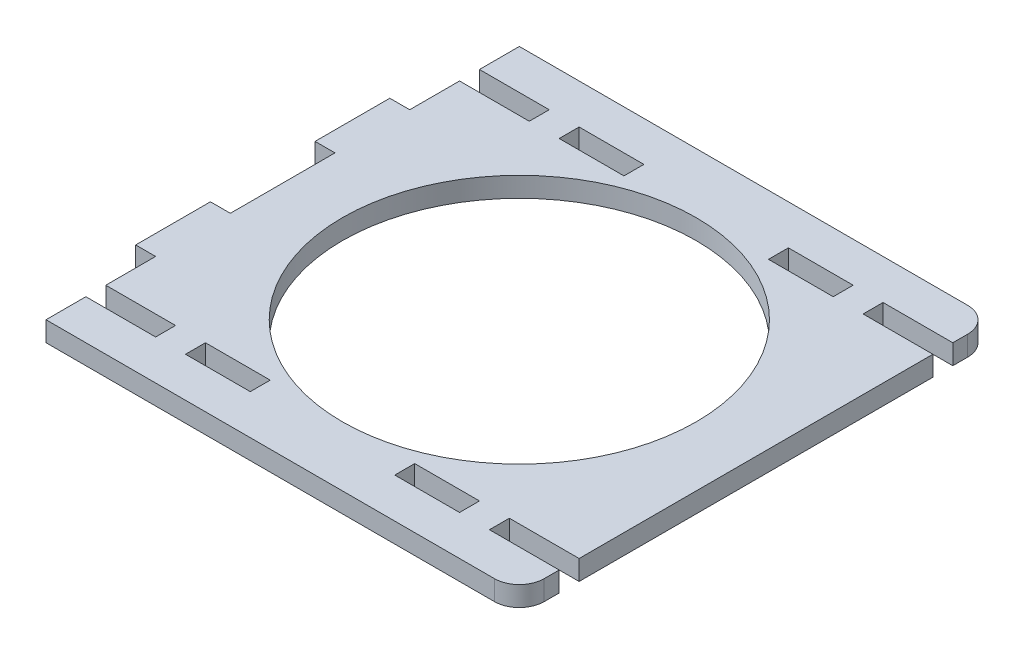
from build123d import *

# Parameters (mm, degrees)
SKETCH1_W           = 95
SKETCH1_H           = 95
SKETCH1_R           = 35.5
BOSS_EXTRUDE1_DEPTH = 2
SKETCH3_W           = 14
SKETCH3_H           = 4
SKETCH3_W_2         = 13
CUT_EXTRUDE5_DEPTH  = 68.294130502
SKETCH4_W           = 15
SKETCH4_H           = 4
BOSS_EXTRUDE2_DEPTH = 4
FILLET1_R           = 5


with BuildPart() as part:
    # Sketch1 → Boss-Extrude1 (new, symmetric)
    with BuildSketch(Plane(origin=(0, 0, 0), x_dir=(1, 0, 0), z_dir=(0, 1, 0))):
        Rectangle(SKETCH1_W, SKETCH1_H)
        Circle(SKETCH1_R, mode=Mode.SUBTRACT)
    extrude(amount=BOSS_EXTRUDE1_DEPTH, both=True)

    # Sketch3 → Cut-Extrude5 (cut, through all)
    with BuildSketch(Plane(origin=(0, 2, 0), x_dir=(1, 0, 0), z_dir=(0, 1, 0))):
        with Locations((-40.5, -37.5)):
            Rectangle(SKETCH3_W, SKETCH3_H)
        with Locations((-40.5, 37.5)):
            Rectangle(SKETCH3_W, SKETCH3_H)
        with Locations((21, 37.5)):
            Rectangle(SKETCH3_W_2, SKETCH3_H)
        with Locations((40.5, -37.5)):
            Rectangle(SKETCH3_W, SKETCH3_H)
        with Locations((40.5, 37.5)):
            Rectangle(SKETCH3_W, SKETCH3_H)
        with Locations((21, -37.5)):
            Rectangle(SKETCH3_W_2, SKETCH3_H)
        with Locations((-21, -37.5)):
            Rectangle(SKETCH3_W_2, SKETCH3_H)
        with Locations((-21, 37.5)):
            Rectangle(SKETCH3_W_2, SKETCH3_H)
    extrude(amount=-CUT_EXTRUDE5_DEPTH, mode=Mode.SUBTRACT)

    # Sketch4 → Boss-Extrude2 (add)
    with BuildSketch(Plane.ZY.offset(47.5)):
        with Locations((-18, 0)):
            Rectangle(SKETCH4_W, SKETCH4_H)
        with Locations((18, 0)):
            Rectangle(SKETCH4_W, SKETCH4_H)
    extrude(amount=BOSS_EXTRUDE2_DEPTH)

    # Fillet1
    fillet1_edges = [part.edges().sort_by_distance(p)[0] for p in [
        (47.5, 0, -47.5),
        (47.5, 0, 47.5),
    ]]
    fillet(fillet1_edges, radius=FILLET1_R)


solid = part.part
